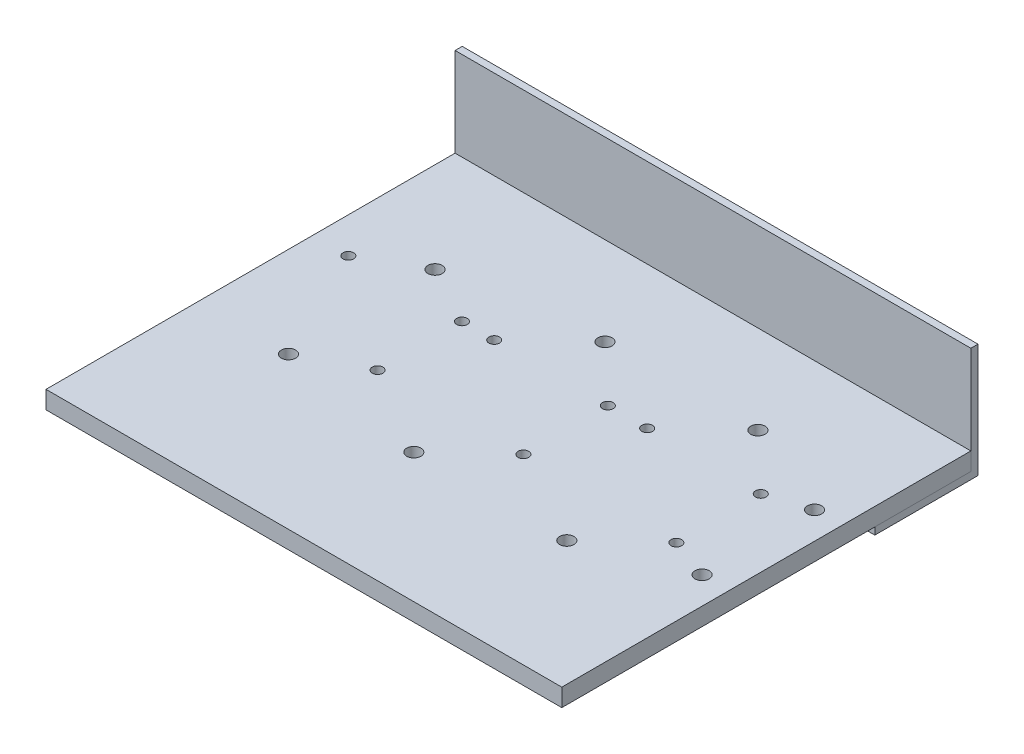
from build123d import *

# Parameters (mm, degrees)
SKETCH1_W           = 145
SKETCH1_H           = 115
BOSS_EXTRUDE1_DEPTH = 5
EXTRUDE_THIN1_DEPTH = 145
SKETCH3_R           = 1.5
SKETCH3_R_2         = 2
CUT_EXTRUDE1_DEPTH  = 98.064411604
SKETCH4_R           = 8
CUT_EXTRUDE2_DEPTH  = 2


with BuildPart() as part:
    # Sketch1 → Boss-Extrude1 (new body)
    with BuildSketch(Plane(origin=(0, 0, 0), x_dir=(1, 0, 0), z_dir=(0, 1, 0))):
        Rectangle(SKETCH1_W, SKETCH1_H)
    extrude(amount=BOSS_EXTRUDE1_DEPTH)

    # Sketch3 → Cut-Extrude1 (cut, through all)
    with BuildSketch(Plane(origin=(0, 5, 0), x_dir=(1, 0, 0), z_dir=(0, 1, 0))):
        with Locations(Location((-62.5, 17.5, 0), (0, 0, 270))):
            Circle(SKETCH3_R)
        with Locations(Location((-30.568159754, 17.5, 0), (0, 0, 270))):
            Circle(SKETCH3_R)
        with Locations(Location((-30.568159754, -6.226569904, 0), (0, 0, 270))):
            Circle(SKETCH3_R)
        with Locations(Location((-21.5, 17.5, 0), (0, 0, 270))):
            Circle(SKETCH3_R)
        with Locations(Location((10.431840246, 17.5, 0), (0, 0, 270))):
            Circle(SKETCH3_R)
        with Locations(Location((10.431840246, -6.226569904, 0), (0, 0, 270))):
            Circle(SKETCH3_R)
        with Locations(Location((21.5, 17.5, 0), (0, 0, 270))):
            Circle(SKETCH3_R)
        with Locations(Location((53.431840246, 17.5, 0), (0, 0, 270))):
            Circle(SKETCH3_R)
        with Locations(Location((53.431840246, -6.226569904, 0), (0, 0, 270))):
            Circle(SKETCH3_R)
        with Locations(Location((64.870084174, 21.179295002, 0), (0, 0, 270))):
            Circle(SKETCH3_R_2)
        with Locations(Location((64.870084174, -10.437925669, 0), (0, 0, 270))):
            Circle(SKETCH3_R_2)
        with Locations(Location((-46.993659826, -14.842716188, 0), (0, 0, 270))):
            Circle(SKETCH3_R_2)
        with Locations(Location((-46.993659826, 26.358666589, 0), (0, 0, 270))):
            Circle(SKETCH3_R_2)
        with Locations(Location((-5.493659826, 32.618936328, 0), (0, 0, 270))):
            Circle(SKETCH3_R_2)
        with Locations(Location((37.506340174, 32.618936328, 0), (0, 0, 270))):
            Circle(SKETCH3_R_2)
        with Locations(Location((-5.493659826, -21.102985926, 0), (0, 0, 270))):
            Circle(SKETCH3_R_2)
        with Locations(Location((37.506340174, -21.102985926, 0), (0, 0, 270))):
            Circle(SKETCH3_R_2)
    extrude(amount=-CUT_EXTRUDE1_DEPTH, mode=Mode.SUBTRACT)


with BuildPart() as body_2:
    # Sketch2 → Extrude-Thin1 (new body)
    with BuildSketch(Plane.ZY.offset(72.5)):
        Polygon((-30.5, 0), (-57.5, 0), (-57.5, 30), (-59.5, 30), (-59.5, -2), (-30.5, -2), align=None)
    extrude(amount=-EXTRUDE_THIN1_DEPTH)

    # Sketch4 → Cut-Extrude2 (cut)
    with BuildSketch(Plane.XZ.offset(2)):
        with Locations((-5.493659826, -32.618936328)):
            Circle(SKETCH4_R)
        with Locations((37.506340174, -32.618936328)):
            Circle(SKETCH4_R)
    extrude(amount=-CUT_EXTRUDE2_DEPTH, mode=Mode.SUBTRACT)


solid = Compound([part.part, body_2.part])
